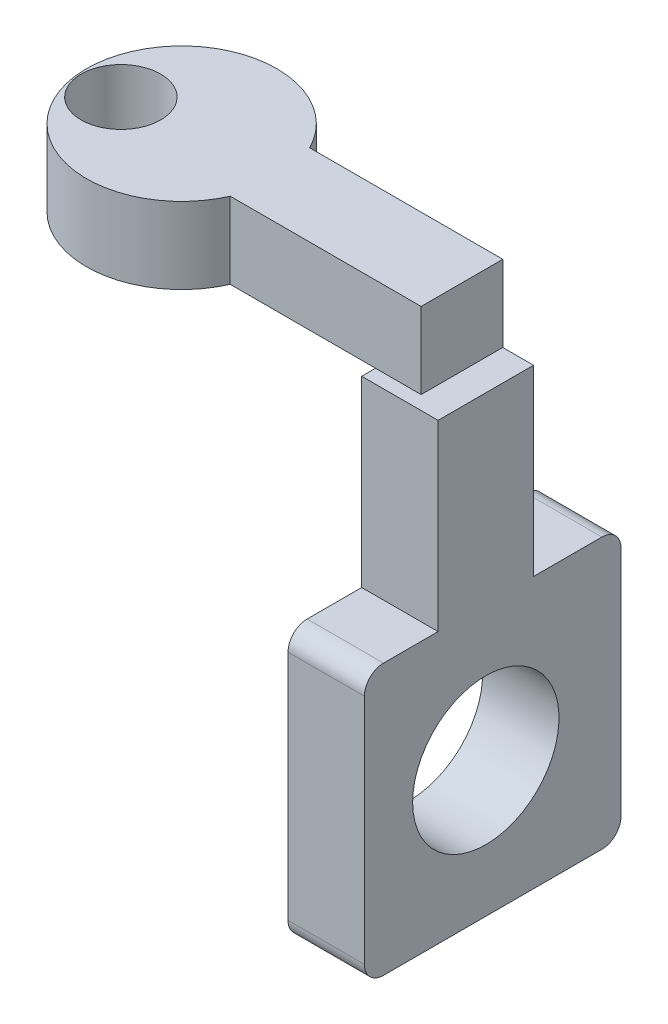
from build123d import *

# Parameters (mm, degrees)
Y_KSEKLIK_EKSTR_ZYON1_DEPTH = 12
IZIM2_W                     = 12
IZIM2_H                     = 15
Y_KSEKLIK_EKSTR_ZYON2_DEPTH = 71.25
IZIM3_W                     = 12
IZIM3_H                     = 42.5
Y_KSEKLIK_EKSTR_ZYON3_DEPTH = 13.75
IZIM4_W                     = 12
IZIM4_H                     = 42.5
Y_KSEKLIK_EKSTR_ZYON4_DEPTH = 13.75
F_23_0_23_AP_DELIK1_D       = 23
F_12_5_12_5_AP_DELIK1_D     = 12.5
F_12_5_12_5_AP_DELIK1_DEPTH = 83.25
RADYUS1_R                   = 3


with BuildPart() as part:
    # Çizim1 → Yükseklik-Ekstrüzyon1 (new body)
    with BuildSketch(Plane.XZ.offset(-37.9375)):
        with BuildLine():
            Line((-5.986499419, 12.829003496), (-35.986499419, 12.829003496))
            ThreePointArc((-35.986499419, 12.829003496), (-64.636078524, 7.171917786), (-36.327694661, 0))
            Line((-36.327694661, 0), (-5.986499419, 0))
            Line((-5.986499419, 0), (-5.986499419, 12.829003496))
        make_face()
    extrude(amount=-Y_KSEKLIK_EKSTR_ZYON1_DEPTH)

    # Çizim2 → Yükseklik-Ekstrüzyon2 (add)
    with BuildSketch(Plane.XZ.offset(-37.9375)):
        with Locations((-7.153440428, 7.5)):
            Rectangle(IZIM2_W, IZIM2_H)
    extrude(amount=Y_KSEKLIK_EKSTR_ZYON2_DEPTH)

    # Çizim3 → Yükseklik-Ekstrüzyon3 (add)
    with BuildSketch(Plane(origin=(0, 0, 0), x_dir=(-1, 0, 0), z_dir=(0, 0, -1))):
        with Locations((7.153440428, -12.0625)):
            Rectangle(IZIM3_W, IZIM3_H)
    extrude(amount=Y_KSEKLIK_EKSTR_ZYON3_DEPTH)

    # Çizim4 → Yükseklik-Ekstrüzyon4 (add)
    with BuildSketch(Plane.XY.offset(12.829003496)):
        with Locations((-7.153440428, -12.0625)):
            Rectangle(IZIM4_W, IZIM4_H)
    extrude(amount=Y_KSEKLIK_EKSTR_ZYON4_DEPTH)

    # Ø23.0 (23) Çap Delik1 (through all)
    with Locations(Plane.ZY.offset(13.153440428)):
        with Locations((7.5, -12.0625)):
            Hole(F_23_0_23_AP_DELIK1_D / 2)

    # Ø12.5 (12.5) Çap Delik1
    with Locations(Plane(origin=(0, 49.9375, 0), x_dir=(1, 0, 0), z_dir=(0, 1, 0))):
        with Locations((-58.080346996, -7.920331509)):
            Hole(F_12_5_12_5_AP_DELIK1_D / 2, depth=F_12_5_12_5_AP_DELIK1_DEPTH)

    # Radyus1
    radyus1_edges = [part.edges().sort_by_distance(p)[0] for p in [
        (-7.153440428, -33.3125, -13.75),
        (-7.153440428, 9.1875, -13.75),
        (-7.153440428, -33.3125, 26.579003496),
        (-7.153440428, 9.1875, 26.579003496),
    ]]
    fillet(radyus1_edges, radius=RADYUS1_R)


solid = part.part
